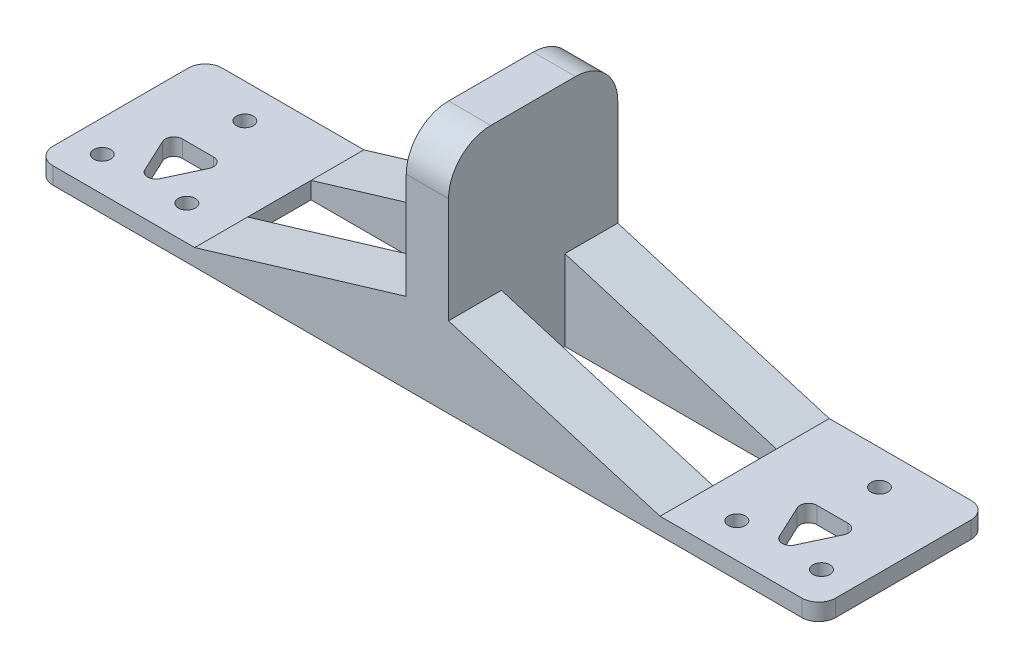
from build123d import *

# Parameters (mm, degrees)
SKETCH_1_W               = 185
SKETCH_1_H               = 40
EXTRUDE_1_DEPTH          = 4
CUT_EXTRUDE_1_DEPTH      = 95.721961551
CUT_EXTRUDE_1_DEPTH_BACK = 95.721961551
SKETCH_2_R               = 2
SKETCH_3_W               = 10
SKETCH_3_H               = 40
EXTRUDE_2_DEPTH          = 50
EXTRUDE_3_DEPTH          = 20
CUT_EXTRUDE_2_DEPTH      = 108.033873143
CUT_EXTRUDE_2_DEPTH_BACK = 108.033873143
SKETCH_5_W               = 50
SKETCH_5_H               = 15
FILLET_1_R               = 10
FILLET_2_R               = 4
FILLET_3_R               = 2


with BuildPart() as part:
    # 草图1 → 凸台-拉伸1 (new body)
    with BuildSketch(Plane(origin=(0, 0, 0), x_dir=(1, 0, 0), z_dir=(0, 1, 0))):
        Rectangle(SKETCH_1_W, SKETCH_1_H)
    extrude(amount=-EXTRUDE_1_DEPTH)

    # 草图2 → 切除-拉伸1 (cut, two sides: drawn at the far end of the back side and taken through both)
    with BuildSketch(Plane(origin=(0, 0, 0), x_dir=(1, 0, 0), z_dir=(0, 1, 0)).offset(-CUT_EXTRUDE_1_DEPTH_BACK)):
        with Locations(Location((-75, 11.85, 0), (0, 0, 270))):
            Circle(SKETCH_2_R)
        with Locations(Location((-65, -11.85, 0), (0, 0, 270))):
            Circle(SKETCH_2_R)
        with Locations(Location((-85, -11.85, 0), (0, 0, 270))):
            Circle(SKETCH_2_R)
        with Locations(Location((65, -11.85, 0), (0, 0, 270))):
            Circle(SKETCH_2_R)
        with Locations(Location((85, -11.85, 0), (0, 0, 270))):
            Circle(SKETCH_2_R)
        with Locations(Location((75, 11.85, 0), (0, 0, 270))):
            Circle(SKETCH_2_R)
    extrude(amount=CUT_EXTRUDE_1_DEPTH + CUT_EXTRUDE_1_DEPTH_BACK, mode=Mode.SUBTRACT)

    # 草图3 → 凸台-拉伸2 (add)
    with BuildSketch(Plane(origin=(0, 0, 0), x_dir=(1, 0, 0), z_dir=(0, 1, 0))):
        Rectangle(SKETCH_3_W, SKETCH_3_H)
    extrude(amount=EXTRUDE_2_DEPTH)

    # 草图4 → 凸台-拉伸3 (add, symmetric)
    with BuildSketch(Plane.XY):
        Polygon((-5, 0), (-5, 15), (-55, 0), align=None)
        Polygon((5, 15), (55, 0), (5, 0), align=None)
    extrude(amount=EXTRUDE_3_DEPTH, both=True)

    # 草图5 → 切除-拉伸2 (cut, two sides: drawn at the far end of the back side and taken through both)
    with BuildSketch(Plane(origin=(0, 0, 0), x_dir=(1, 0, 0), z_dir=(0, 1, 0)).offset(-CUT_EXTRUDE_2_DEPTH_BACK)):
        with Locations((-30, 0)):
            Rectangle(SKETCH_5_W, SKETCH_5_H)
        Polygon((-81.842684811, 0.77750414), (-75, -13.85), (-68.157315189, 0.77750414), align=None)
        Polygon((75, -13.85), (68.157315189, 0.77750414), (81.842684811, 0.77750414), align=None)
        with Locations((30, 0)):
            Rectangle(SKETCH_5_W, SKETCH_5_H)
    extrude(amount=CUT_EXTRUDE_2_DEPTH + CUT_EXTRUDE_2_DEPTH_BACK, mode=Mode.SUBTRACT)

    # 圆角1
    fillet_1_edges = [part.edges().sort_by_distance(p)[0] for p in [
        (0, 50, -20),
        (0, 50, 20),
    ]]
    fillet(fillet_1_edges, radius=FILLET_1_R)

    # 圆角2
    fillet_2_edges = [part.edges().sort_by_distance(p)[0] for p in [
        (92.5, -2, 20),
        (-92.5, -2, 20),
        (-92.5, -2, -20),
        (92.5, -2, -20),
    ]]
    fillet(fillet_2_edges, radius=FILLET_2_R)

    # 圆角3
    fillet_3_edges = [part.edges().sort_by_distance(p)[0] for p in [
        (-81.842684811, -2, -0.77750414),
        (-68.157315189, -2, -0.77750414),
        (-75, -2, 13.85),
        (81.842684811, -2, -0.77750414),
        (75, -2, 13.85),
        (68.157315189, -2, -0.77750414),
    ]]
    fillet(fillet_3_edges, radius=FILLET_3_R)


solid = part.part
